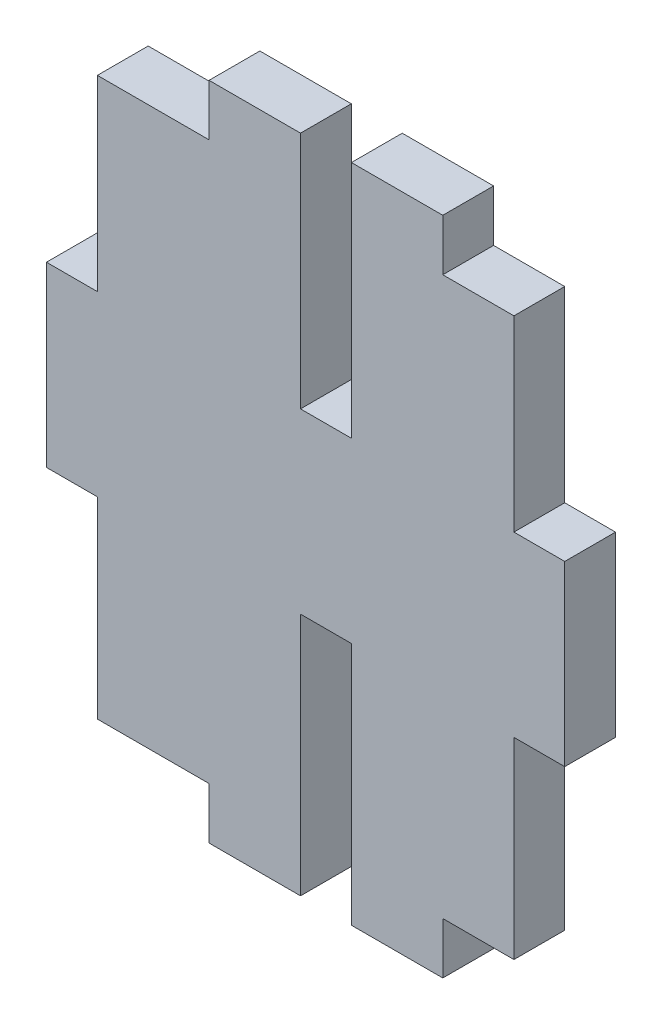
from build123d import *

# Parameters (mm, degrees)
ESQUISSE1_W             = 51
ESQUISSE1_H             = 65
BOSS_EXTRU_1_DEPTH      = 5
ESQUISSE2_W             = 5.01
ESQUISSE2_H             = 23.5
ESQUISSE2_H_2           = 24.01
ESQUISSE2_W_2           = 5
ENL_V_MAT_EXTRU_1_DEPTH = 5
ESQUISSE3_W             = 16
ESQUISSE3_H             = 5.07
ESQUISSE3_W_2           = 12
ENL_V_MAT_EXTRU_2_DEPTH = 5


with BuildPart() as part:
    # Esquisse1 → Boss.-Extru.1 (new body)
    with BuildSketch(Plane.XY):
        Rectangle(ESQUISSE1_W, ESQUISSE1_H)
    extrude(amount=BOSS_EXTRU_1_DEPTH)

    # Esquisse2 → Enlèv. mat.-Extru.1 (cut)
    with BuildSketch(Plane.XY.offset(5)):
        with Locations((-22.995, 20.75)):
            Rectangle(ESQUISSE2_W, ESQUISSE2_H)
        with Locations((-22.995, -20.495)):
            Rectangle(ESQUISSE2_W, ESQUISSE2_H_2)
        with Locations((2.005, 20.75)):
            Rectangle(ESQUISSE2_W, ESQUISSE2_H)
        with Locations((2.005, -20.495)):
            Rectangle(ESQUISSE2_W, ESQUISSE2_H_2)
        with Locations((23, 20.75)):
            Rectangle(ESQUISSE2_W_2, ESQUISSE2_H)
        with Locations((23, -20.495)):
            Rectangle(ESQUISSE2_W_2, ESQUISSE2_H_2)
    extrude(amount=-ENL_V_MAT_EXTRU_1_DEPTH, mode=Mode.SUBTRACT)

    # Esquisse3 → Enlèv. mat.-Extru.2 (cut)
    with BuildSketch(Plane.XY.offset(5)):
        with Locations((-17.5, 29.965)):
            Rectangle(ESQUISSE3_W, ESQUISSE3_H)
        with Locations((19.5, 29.965)):
            Rectangle(ESQUISSE3_W_2, ESQUISSE3_H)
        with Locations((19.5, -29.965)):
            Rectangle(ESQUISSE3_W_2, ESQUISSE3_H)
        with Locations((-17.5, -29.965)):
            Rectangle(ESQUISSE3_W, ESQUISSE3_H)
    extrude(amount=-ENL_V_MAT_EXTRU_2_DEPTH, mode=Mode.SUBTRACT)


solid = part.part
